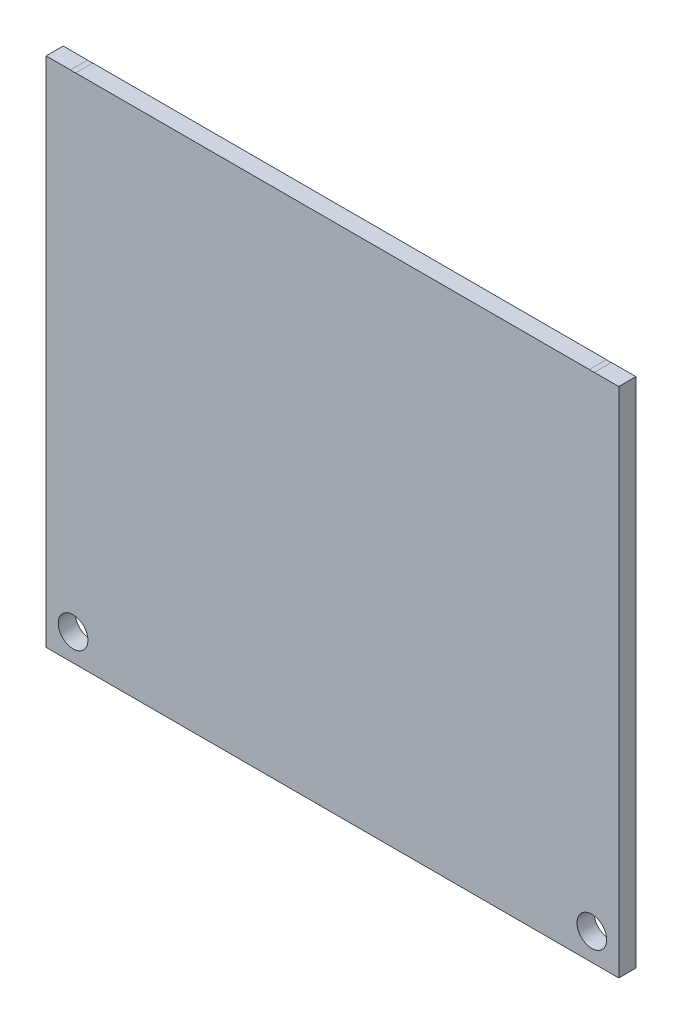
from build123d import *

# Parameters (mm, degrees)
SKETCH1_W           = 106.2
SKETCH1_H           = 95
BOSS_EXTRUDE1_DEPTH = 3.175
CUT_EXTRUDE1_REACH  = 73.316
SKETCH2_R           = 2.75


with BuildPart() as part:
    # Sketch1 → Boss-Extrude1 (new body)
    with BuildSketch(Plane.XY):
        Rectangle(SKETCH1_W, SKETCH1_H)
    extrude(amount=BOSS_EXTRUDE1_DEPTH)

    # Sketch2 → Cut-Extrude1 (cut, up to next)
    with BuildSketch(Plane(origin=(0, 0, 0), x_dir=(-1, 0, 0), z_dir=(0, 0, -1)), mode=Mode.PRIVATE) as cut_extrude1_sk1:
        with Locations((-48.1, 50.21)):
            Circle(SKETCH2_R)
    cut_extrude1_tool1 = extrude(cut_extrude1_sk1.sketch, amount=-CUT_EXTRUDE1_REACH, mode=Mode.PRIVATE) & part.part
    # Sketch2 → Cut-Extrude1 (cut, up to next)
    with BuildSketch(Plane(origin=(0, 0, 0), x_dir=(-1, 0, 0), z_dir=(0, 0, -1)), mode=Mode.PRIVATE) as cut_extrude1_sk2:
        with Locations((-48.1, -42.5)):
            Circle(SKETCH2_R)
    cut_extrude1_tool2 = extrude(cut_extrude1_sk2.sketch, amount=-CUT_EXTRUDE1_REACH, mode=Mode.PRIVATE) & part.part
    # Sketch2 → Cut-Extrude1 (cut, up to next)
    with BuildSketch(Plane(origin=(0, 0, 0), x_dir=(-1, 0, 0), z_dir=(0, 0, -1)), mode=Mode.PRIVATE) as cut_extrude1_sk3:
        with Locations((48.1, -42.5)):
            Circle(SKETCH2_R)
    cut_extrude1_tool3 = extrude(cut_extrude1_sk3.sketch, amount=-CUT_EXTRUDE1_REACH, mode=Mode.PRIVATE) & part.part
    # Sketch2 → Cut-Extrude1 (cut, up to next)
    with BuildSketch(Plane(origin=(0, 0, 0), x_dir=(-1, 0, 0), z_dir=(0, 0, -1)), mode=Mode.PRIVATE) as cut_extrude1_sk4:
        with Locations((48.1, 50.21)):
            Circle(SKETCH2_R)
    cut_extrude1_tool4 = extrude(cut_extrude1_sk4.sketch, amount=-CUT_EXTRUDE1_REACH, mode=Mode.PRIVATE) & part.part
    add(cut_extrude1_tool1.solids().sort_by_distance((48.1, 50.21, 0))[0], mode=Mode.SUBTRACT)
    add(cut_extrude1_tool2.solids().sort_by_distance((48.1, -42.5, 0))[0], mode=Mode.SUBTRACT)
    add(cut_extrude1_tool3.solids().sort_by_distance((-48.1, -42.5, 0))[0], mode=Mode.SUBTRACT)
    add(cut_extrude1_tool4.solids().sort_by_distance((-48.1, 50.21, 0))[0], mode=Mode.SUBTRACT)


solid = part.part
